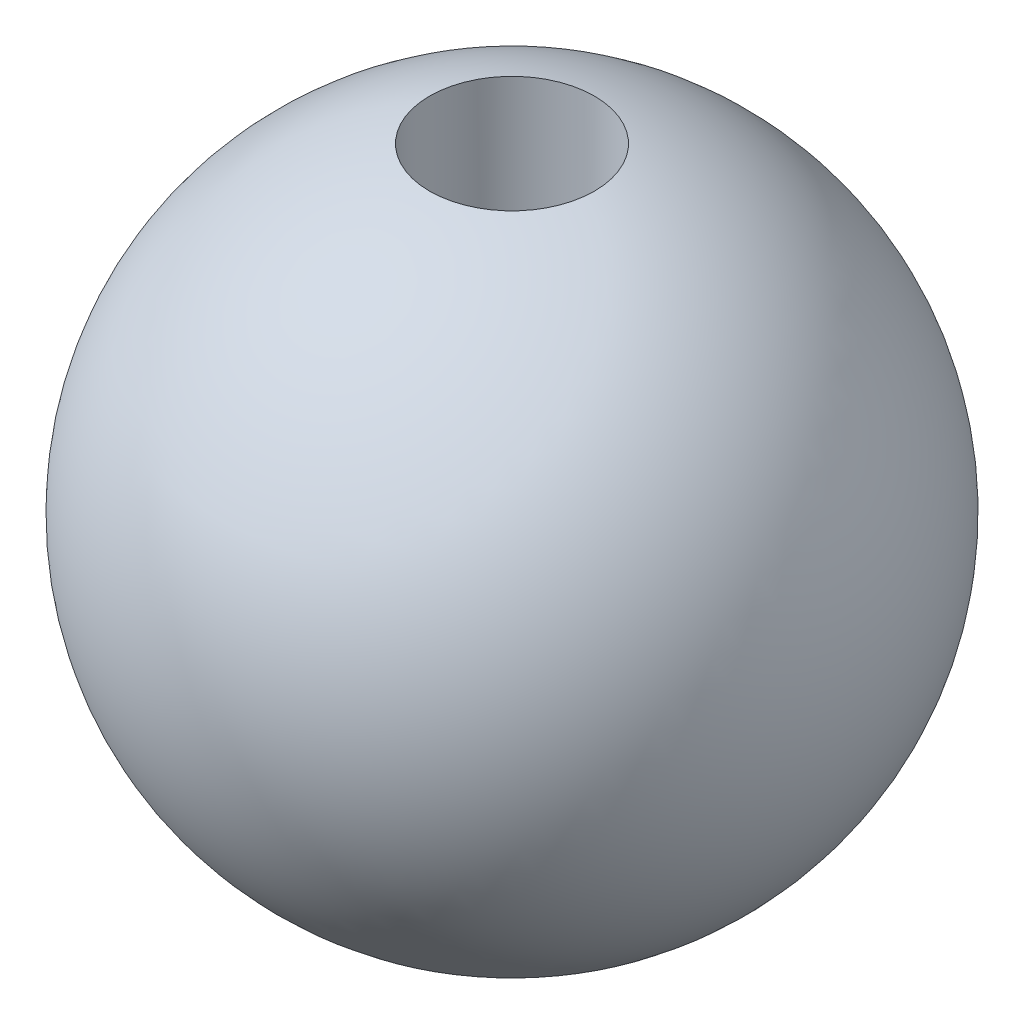
from build123d import *

# Parameters (mm, degrees)
M6_TAPPED_HOLE1_D     = 5
M6_TAPPED_HOLE1_DEPTH = 6


with BuildPart() as part:
    # Sketch1 → Revolve1 (revolve)
    with BuildSketch(Plane.XY):
        with BuildLine():
            Line((0, 10), (0, -10))
            ThreePointArc((0, -10), (-10, 0), (0, 10))
        make_face()
    revolve(axis=Axis((0, 10, 0), (0, -1, 0)))

    # M6 Tapped Hole1
    with Locations(Plane(origin=(0, 10, 0), x_dir=(1, 0, 0), z_dir=(0, 1, 0))):
        with Locations((0, 0)):
            Hole(M6_TAPPED_HOLE1_D / 2, depth=M6_TAPPED_HOLE1_DEPTH)


solid = part.part
